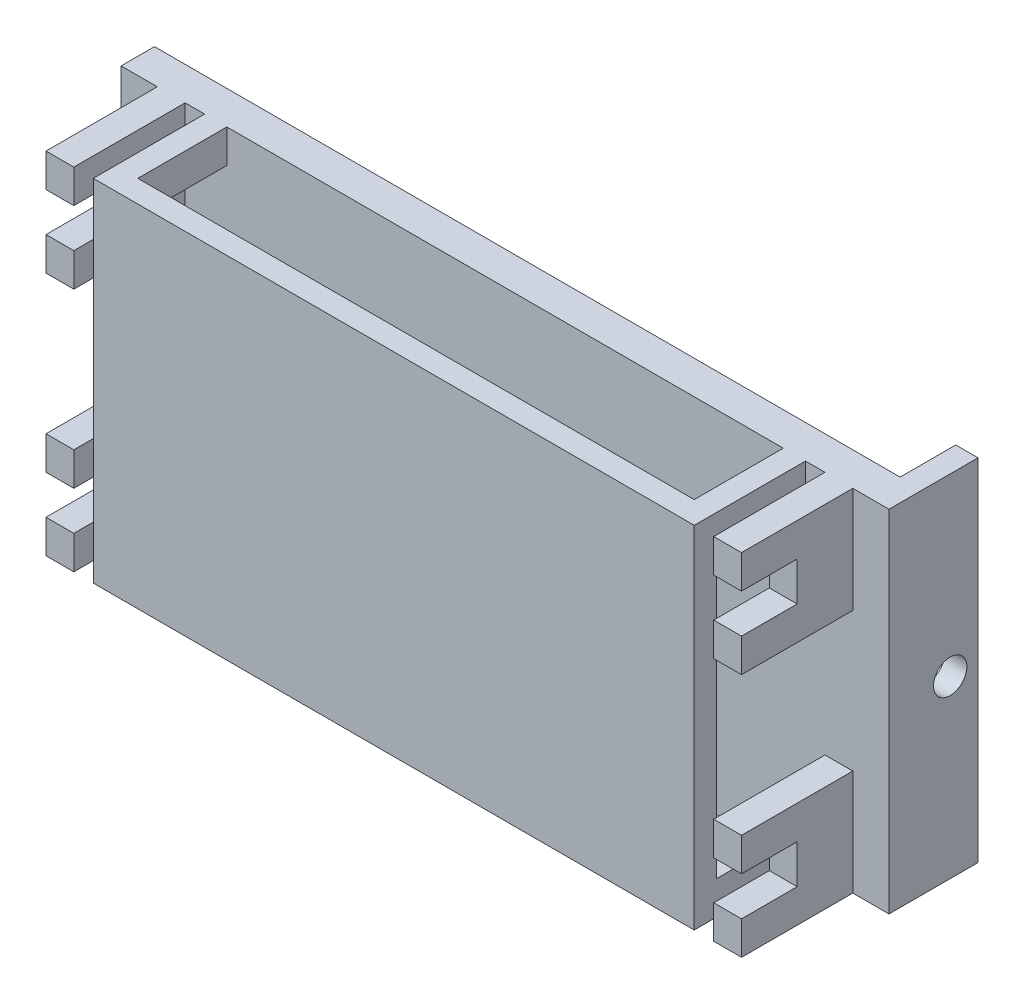
from build123d import *

# Parameters (mm, degrees)
ESBO_O1_W                  = 69
ESBO_O1_H                  = 31.5
RESSALTO_EXTRUS_O1_DEPTH   = 6
ESBO_O2_W                  = 5
ESBO_O2_H                  = 19
RESSALTO_EXTRUS_O2_DEPTH   = 20
ESBO_O3_W                  = 5
ESBO_O3_H                  = 7
CORTE_EXTRUS_O1_DEPTH      = 10
ESBO_O4_W                  = 4
ESBO_O4_H                  = 31.5
RESSALTO_EXTRUS_O3_DEPTH   = 20
CORTE_EXTRUS_O2_DEPTH      = 4
ESBO_O6_W                  = 4
ESBO_O6_H                  = 6
RESSALTO_EXTRUS_O4_DEPTH   = 50
ESBO_O7_W                  = 4
ESBO_O7_H                  = 63
RESSALTO_EXTRUS_O5_DEPTH   = 10
CORTE_EXTRUS_O3_DEPTH      = 144.957450913
CORTE_EXTRUS_O3_DEPTH_BACK = 144.957450913
ESBO_O8_R                  = 3
ESBO_O13_W                 = 100
ESBO_O13_H                 = 4
RESSALTO_EXTRUS_O6_DEPTH   = 53


with BuildPart() as part:
    # Esboço1 → Ressalto-extrusão1 (new body)
    with BuildSketch(Plane.XY):
        with Locations((-34.5, -15.931977108)):
            Rectangle(ESBO_O1_W, ESBO_O1_H)
    extrude(amount=RESSALTO_EXTRUS_O1_DEPTH)

    # Esboço2 → Ressalto-extrusão2 (add)
    with BuildSketch(Plane.XY.offset(6)):
        with Locations((-60, -22.181977108)):
            Rectangle(ESBO_O2_W, ESBO_O2_H)
    extrude(amount=RESSALTO_EXTRUS_O2_DEPTH)

    # Esboço3 → Corte-extrusão1 (cut)
    with BuildSketch(Plane.XY.offset(26)):
        with Locations((-60, -22.181977108)):
            Rectangle(ESBO_O3_W, ESBO_O3_H)
    extrude(amount=-CORTE_EXTRUS_O1_DEPTH, mode=Mode.SUBTRACT)

    # Esboço4 → Ressalto-extrusão3 (add)
    with BuildSketch(Plane.XY.offset(6)):
        with Locations((-52, -15.931977108)):
            Rectangle(ESBO_O4_W, ESBO_O4_H)
    extrude(amount=RESSALTO_EXTRUS_O3_DEPTH)

    # Esboço5 → Corte-extrusão2 (cut)
    with BuildSketch(Plane(origin=(-50, 0, 0), x_dir=(0, 0, -1), z_dir=(1, 0, 0))):
        Polygon((-22, -25.681977108), (-6, -25.681977108), (-6, -0.181977108), (-22, -0.181977108), (-22, -6.181977108), align=None)
    extrude(amount=-CORTE_EXTRUS_O2_DEPTH, mode=Mode.SUBTRACT)

    # Esboço6 → Ressalto-extrusão4 (add)
    with BuildSketch(Plane(origin=(-50, 0, 0), x_dir=(0, 0, -1), z_dir=(1, 0, 0))):
        with Locations((-24, -28.681977108)):
            Rectangle(ESBO_O6_W, ESBO_O6_H)
    extrude(amount=RESSALTO_EXTRUS_O4_DEPTH)

    # Espelhar10: part across plane


with BuildPart() as part_1:
    add(part.part)
    add(part.part.mirror(Plane.ZX.offset(-0.181977108)))

    # Espelhar11: part across plane


with BuildPart() as part_2:
    add(part_1.part)
    add(part_1.part.mirror(Plane(origin=(0, 0, 0), x_dir=(0, 0, 1), z_dir=(1, 0, 0))))

    # Esboço7 → Ressalto-extrusão5 (add)
    with BuildSketch(Plane(origin=(0, 0, 0), x_dir=(-1, 0, 0), z_dir=(0, 0, -1))):
        with Locations((-67, -0.181977108)):
            Rectangle(ESBO_O7_W, ESBO_O7_H)
    extrude(amount=RESSALTO_EXTRUS_O5_DEPTH)

    # Esboço8 → Corte-extrusão3 (cut, two sides: drawn at the far end of the back side and taken through both)
    with BuildSketch(Plane(origin=(69, 0, 0), x_dir=(0, 0, -1), z_dir=(1, 0, 0)).offset(-CORTE_EXTRUS_O3_DEPTH_BACK)):
        with Locations((5, -0.181977108)):
            Circle(ESBO_O8_R)
    extrude(amount=CORTE_EXTRUS_O3_DEPTH + CORTE_EXTRUS_O3_DEPTH_BACK, mode=Mode.SUBTRACT)

    # Esboço13 → Ressalto-extrusão6 (add)
    with BuildSketch(Plane(origin=(0, -25.681977108, 0), x_dir=(1, 0, 0), z_dir=(0, 1, 0))):
        with Locations((0, -24)):
            Rectangle(ESBO_O13_W, ESBO_O13_H)
    extrude(amount=RESSALTO_EXTRUS_O6_DEPTH)


solid = part_2.part
